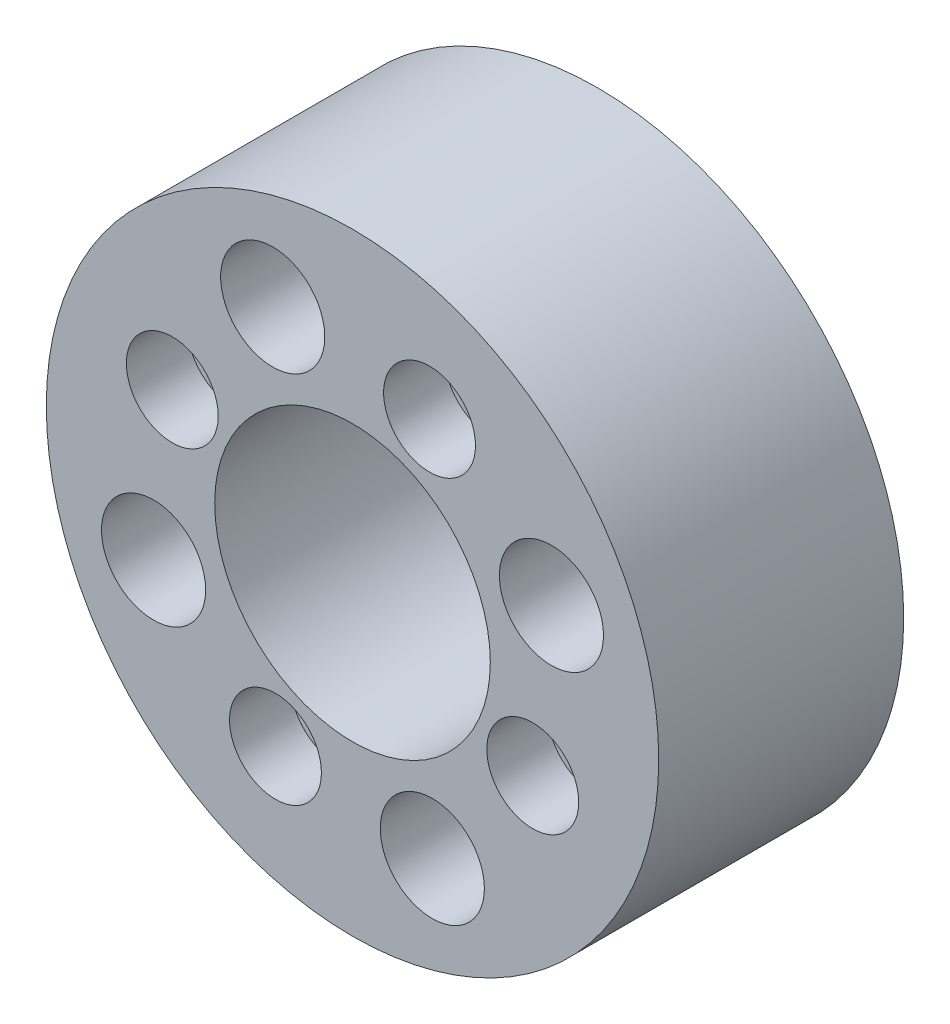
from build123d import *

# Parameters (mm, degrees)
ESQUISSE1_R             = 25
ESQUISSE1_R_2           = 11.25
BOSS_EXTRU_1_DEPTH      = 20
ESQUISSE2_R             = 2.5
ENL_V_MAT_EXTRU_1_DEPTH = 41.620192023
ESQUISSE4_R             = 3.75
ENL_V_MAT_EXTRU_2_DEPTH = 5
ESQUISSE12_R            = 4.25
ENL_V_MAT_EXTRU_6_DEPTH = 7.5


with BuildPart() as part:
    # Esquisse1 → Boss.-Extru.1 (new body)
    with BuildSketch(Plane.XY):
        Circle(ESQUISSE1_R)
        Circle(ESQUISSE1_R_2, mode=Mode.SUBTRACT)
    extrude(amount=BOSS_EXTRU_1_DEPTH)

    # Esquisse2 → Enlèv. mat.-Extru.1 (cut, through all)
    with BuildSketch(Plane.XY.offset(20)):
        with Locations((-14.713385832, 6.286197369)):
            Circle(ESQUISSE2_R)
        with Locations((6.28955657, 14.711950182)):
            Circle(ESQUISSE2_R)
        with Locations((14.713385832, -6.286197369)):
            Circle(ESQUISSE2_R)
        with Locations((-6.28955657, -14.711950182)):
            Circle(ESQUISSE2_R)
    extrude(amount=-ENL_V_MAT_EXTRU_1_DEPTH, mode=Mode.SUBTRACT)

    # Esquisse4 → Enlèv. mat.-Extru.2 (cut)
    with BuildSketch(Plane.XY.offset(20)):
        with Locations((-6.28955657, -14.711950182)):
            Circle(ESQUISSE4_R)
        with Locations((14.713385832, -6.286197369)):
            Circle(ESQUISSE4_R)
        with Locations((6.28955657, 14.711950182)):
            Circle(ESQUISSE4_R)
        with Locations((-14.713385832, 6.286197369)):
            Circle(ESQUISSE4_R)
    extrude(amount=-ENL_V_MAT_EXTRU_2_DEPTH, mode=Mode.SUBTRACT)

    # Esquisse12 → Enlèv. mat.-Extru.6 (cut)
    with BuildSketch(Plane.XY.offset(20)):
        with Locations((16.24178047, 6.515716934)):
            Circle(ESQUISSE12_R)
        with Locations((-16.24178047, -6.515716934)):
            Circle(ESQUISSE12_R)
        with Locations((6.515716934, -16.24178047)):
            Circle(ESQUISSE12_R)
        with Locations((-6.515716934, 16.24178047)):
            Circle(ESQUISSE12_R)
    extrude(amount=-ENL_V_MAT_EXTRU_6_DEPTH, mode=Mode.SUBTRACT)


solid = part.part
